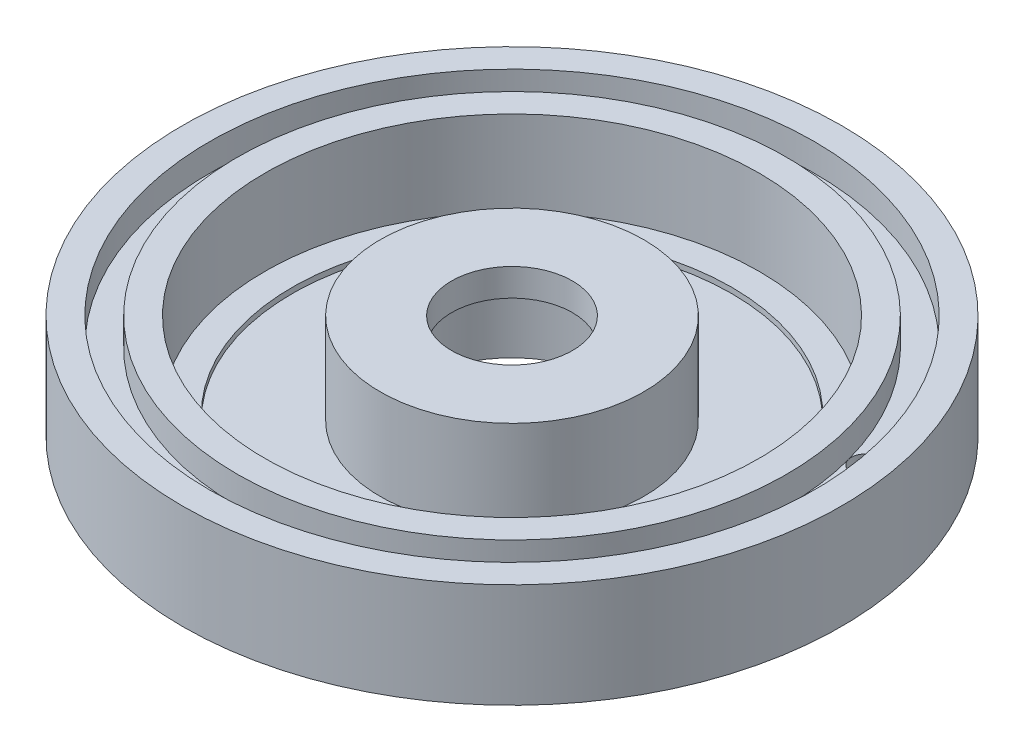
from build123d import *

# Parameters (mm, degrees)
SKETCH1_R             = 60
BOSS_EXTRUDE1_DEPTH   = 19
SKETCH2_R             = 55
SKETCH2_R_2           = 50
CUT_EXTRUDE1_DEPTH    = 5
SKETCH6_W             = 17.5
SKETCH6_H             = 14
M6_TAPPED_HOLE1_D     = 5
M6_TAPPED_HOLE1_DEPTH = 15
M6_TAPPED_HOLE1_TIP   = 1.502151548


with BuildPart() as part:
    # Sketch1 → Boss-Extrude1 (new body)
    with BuildSketch(Plane(origin=(0, 0, 0), x_dir=(1, 0, 0), z_dir=(0, 1, 0))):
        with Locations(Location((0, 0, 0), (0, 0, 270))):
            Circle(SKETCH1_R)
    extrude(amount=BOSS_EXTRUDE1_DEPTH)

    # Sketch2 → Cut-Extrude1 (cut)
    with BuildSketch(Plane(origin=(0, 19, 0), x_dir=(1, 0, 0), z_dir=(0, 1, 0))):
        with Locations(Location((0, 0, 0), (0, 0, 270))):
            Circle(SKETCH2_R)
        with Locations(Location((0, 0, 0), (0, 0, 270))):
            Circle(SKETCH2_R_2, mode=Mode.SUBTRACT)
    extrude(amount=-CUT_EXTRUDE1_DEPTH, mode=Mode.SUBTRACT)

    # Sketch4 → Cut-Revolve1 (revolve, cut)
    with BuildSketch(Plane.XY, mode=Mode.PRIVATE) as cut_revolve1_sk:
        Polygon((45, 19), (45, 3.5), (40, 3.5), (40, 2.5), (0, 2.5), (0, 19), align=None)
    revolve(cut_revolve1_sk.sketch.rotate(Axis((0, 0, 0), (0, 1, 0)), 90), axis=Axis((0, 0, 0), (0, 1, 0)), mode=Mode.SUBTRACT)

    # Sketch5 → Revolve1 (revolve)
    with BuildSketch(Plane.XY, mode=Mode.PRIVATE) as revolve1_sk:
        Polygon((17.5, 0), (17.5, 14), (11, 14), (11, 19), (24, 19), (24, 0), align=None)
    revolve(revolve1_sk.sketch.rotate(Axis((0, 0, 0), (0, 1, 0)), 90), axis=Axis((0, 0, 0), (0, 1, 0)))

    # Sketch6 → Cut-Revolve2 (revolve, cut)
    with BuildSketch(Plane.XY, mode=Mode.PRIVATE) as cut_revolve2_sk:
        with Locations((8.75, 7)):
            Rectangle(SKETCH6_W, SKETCH6_H)
    revolve(cut_revolve2_sk.sketch.rotate(Axis((0, 0, 0), (0, 1, 0)), 90), axis=Axis((0, 0, 0), (0, 1, 0)), mode=Mode.SUBTRACT)

    # M6 Tapped Hole1
    with Locations(Plane(origin=(0, 19, 0), x_dir=(1, 0, 0), z_dir=(0, 1, 0))):
        with Locations((50.71110588, 13.587999868), (50.71110588, -13.587999868)):
            Hole(M6_TAPPED_HOLE1_D / 2, depth=M6_TAPPED_HOLE1_DEPTH)
            with Locations((0, 0, -(M6_TAPPED_HOLE1_DEPTH + M6_TAPPED_HOLE1_TIP / 2))):  # 118° drill point
                Cone(0, M6_TAPPED_HOLE1_D / 2, M6_TAPPED_HOLE1_TIP, mode=Mode.SUBTRACT)


solid = part.part
